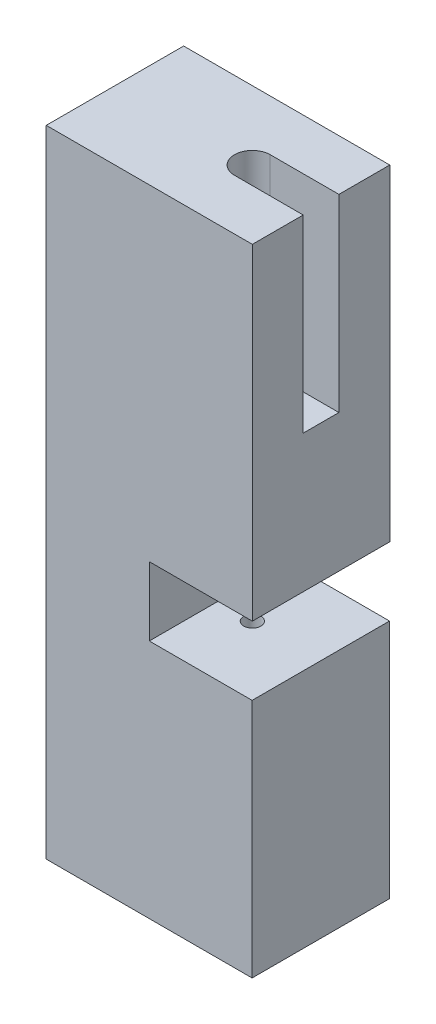
from build123d import *

# Parameters (mm, degrees)
SKETCH1_W                   = 38.1
SKETCH1_H                   = 25.4
BOSS_EXTRUDE1_DEPTH         = 25.4
SKETCH3_R                   = 1.5875
CUT_EXTRUDE2_DEPTH          = 25.4
F_1_4_28_TAPPED_HOLE1_D     = 5.4102
F_1_4_28_TAPPED_HOLE1_DEPTH = 17.23
F_1_4_28_TAPPED_HOLE1_TIP   = 1.625388061
SKETCH2_R                   = 3.18
CUT_EXTRUDE6_DEPTH          = 15.875
SKETCH8_R                   = 1.5875
CUT_EXTRUDE7_DEPTH          = 35.1957966
SKETCH9_W                   = 19.05
SKETCH9_H                   = 25.4
BOSS_EXTRUDE2_DEPTH         = 12.7
SKETCH12_W                  = 38.05497839
SKETCH12_H                  = 25.4
BOSS_EXTRUDE3_DEPTH         = 44.45
CUT_EXTRUDE8_START          = -44.45
SKETCH14_R                  = 1.5875
CUT_EXTRUDE8_DEPTH          = 44.45
F_1_4_28_TAPPED_HOLE2_D     = 5.4102
F_1_4_28_TAPPED_HOLE2_DEPTH = 17.23
F_1_4_28_TAPPED_HOLE2_TIP   = 1.625388061
BOSS_EXTRUDE6_DEPTH         = 34.925


with BuildPart() as part:
    # Sketch1 → Boss-Extrude1 (new body)
    with BuildSketch(Plane(origin=(0, 0, 0), x_dir=(1, 0, 0), z_dir=(0, 1, 0))):
        Rectangle(SKETCH1_W, SKETCH1_H)
    extrude(amount=BOSS_EXTRUDE1_DEPTH)

    # Sketch3 → Cut-Extrude2 (cut)
    with BuildSketch(Plane.ZY.offset(19.05)):
        with Locations((0, 12.7)):
            Circle(SKETCH3_R)
    extrude(amount=-CUT_EXTRUDE2_DEPTH, mode=Mode.SUBTRACT)

    # 1/4-28 Tapped Hole1
    with Locations(Plane.ZY.offset(19.05)):
        with Locations((0, 12.7)):
            Hole(F_1_4_28_TAPPED_HOLE1_D / 2, depth=F_1_4_28_TAPPED_HOLE1_DEPTH)
            with Locations((0, 0, -(F_1_4_28_TAPPED_HOLE1_DEPTH + F_1_4_28_TAPPED_HOLE1_TIP / 2))):  # 118° drill point
                Cone(0, F_1_4_28_TAPPED_HOLE1_D / 2, F_1_4_28_TAPPED_HOLE1_TIP, mode=Mode.SUBTRACT)

    # Sketch2 → Cut-Extrude6 (cut)
    with BuildSketch(Plane(origin=(0, 25.4, 0), x_dir=(1, 0, 0), z_dir=(0, 1, 0))):
        with Locations(Location((6.35, 0, 0), (0, 0, 270))):
            Circle(SKETCH2_R)
    extrude(amount=-CUT_EXTRUDE6_DEPTH, mode=Mode.SUBTRACT)

    # Sketch8 → Cut-Extrude7 (cut, through all)
    with BuildSketch(Plane.XZ):
        with Locations(Location((6.35, 0, 0), (0, 0, 270))):
            Circle(SKETCH8_R)
    extrude(amount=-CUT_EXTRUDE7_DEPTH, mode=Mode.SUBTRACT)

    # Sketch9 → Boss-Extrude2 (add)
    with BuildSketch(Plane.XZ):
        with Locations((-9.525, 0)):
            Rectangle(SKETCH9_W, SKETCH9_H)
    extrude(amount=BOSS_EXTRUDE2_DEPTH)

    # Sketch12 → Boss-Extrude3 (add)
    with BuildSketch(Plane.XZ.offset(12.7)):
        with Locations((-0.022510805, 0)):
            Rectangle(SKETCH12_W, SKETCH12_H)
    extrude(amount=BOSS_EXTRUDE3_DEPTH)

    # Sketch14 → Cut-Extrude8 (cut)
    with BuildSketch(Plane(origin=(0, -12.7, 0), x_dir=(1, 0, 0), z_dir=(0, 1, 0)).offset(CUT_EXTRUDE8_START)):
        with Locations(Location((6.35, 0, 0), (0, 0, 90))):
            Circle(SKETCH14_R)
    extrude(amount=CUT_EXTRUDE8_DEPTH, mode=Mode.SUBTRACT)

    # 1/4-28 Tapped Hole2
    with Locations(Plane(origin=(0, -57.15, 0), x_dir=(-1, 0, 0), z_dir=(0, -1, 0))):
        with Locations((-6.35, 0)):
            Hole(F_1_4_28_TAPPED_HOLE2_D / 2, depth=F_1_4_28_TAPPED_HOLE2_DEPTH)
            with Locations((0, 0, -(F_1_4_28_TAPPED_HOLE2_DEPTH + F_1_4_28_TAPPED_HOLE2_TIP / 2))):  # 118° drill point
                Cone(0, F_1_4_28_TAPPED_HOLE2_D / 2, F_1_4_28_TAPPED_HOLE2_TIP, mode=Mode.SUBTRACT)

    # Sketch24 → Boss-Extrude6 (add)
    with BuildSketch(Plane(origin=(0, 25.4, 0), x_dir=(1, 0, 0), z_dir=(0, 1, 0))):
        with BuildLine():
            Line((6.35, -3.302), (19.05, -3.302))
            Line((19.05, -3.302), (19.05, -12.7))
            Line((19.05, -12.7), (-19.05, -12.7))
            Line((-19.05, -12.7), (-19.05, 12.7))
            Line((-19.05, 12.7), (19.05, 12.7))
            Line((19.05, 12.7), (19.05, 3.302))
            Line((19.05, 3.302), (6.35, 3.302))
            ThreePointArc((6.35, 3.302), (3.048, 0), (6.35, -3.302))
        make_face()
    extrude(amount=BOSS_EXTRUDE6_DEPTH)


solid = part.part
